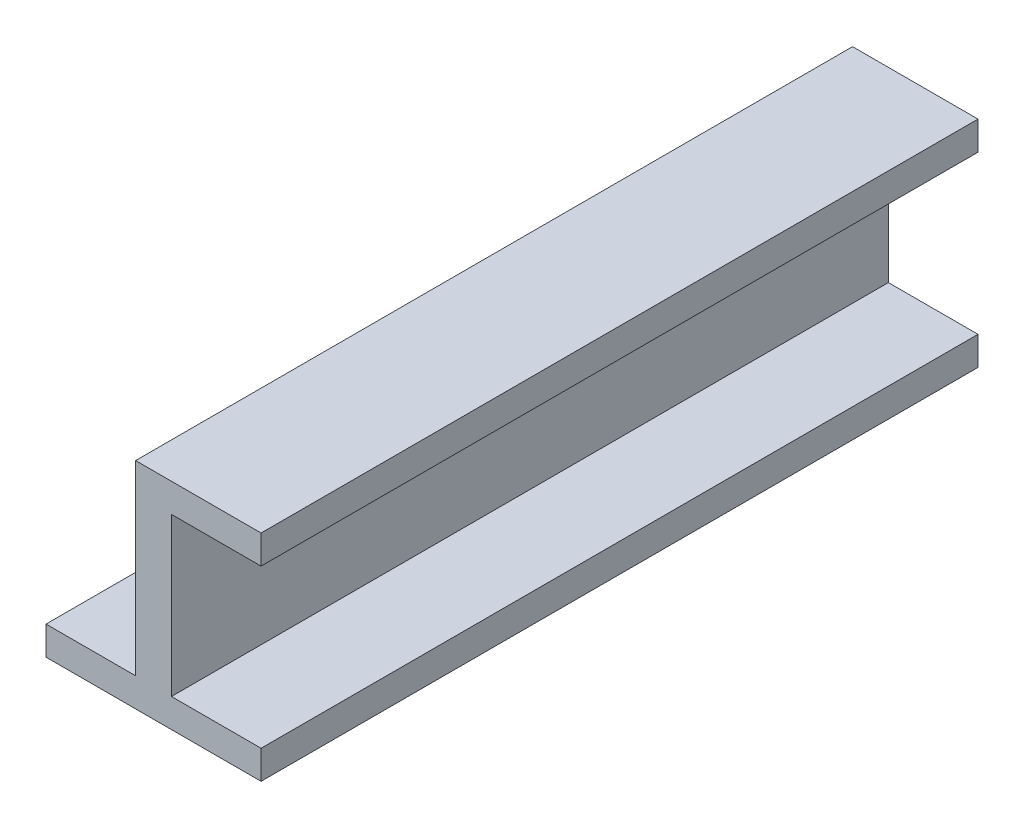
from build123d import *

# Parameters (mm, degrees)
SKETCH_1_W      = 25
SKETCH_1_H      = 8
SKETCH_1_W_2    = 5
EXTRUDE_1_DEPTH = 100


with BuildPart() as part:
    # Эскиз1 → Бобышка-Вытянуть1 (new, symmetric)
    with BuildSketch(Plane.XY):
        with Locations((17.5, -26)):
            Rectangle(SKETCH_1_W, SKETCH_1_H)
        with Locations((2.5, -26)):
            Rectangle(SKETCH_1_W_2, SKETCH_1_H)
        with Locations((-2.5, -26)):
            Rectangle(SKETCH_1_W_2, SKETCH_1_H)
        with Locations((-17.5, -26)):
            Rectangle(SKETCH_1_W, SKETCH_1_H)
        Polygon((0, -22), (5, -22), (5, 22), (0, 22), (0, 30), (-5, 30), (-5, -22), align=None)
        with Locations((17.5, 26)):
            Rectangle(SKETCH_1_W, SKETCH_1_H)
        with Locations((2.5, 26)):
            Rectangle(SKETCH_1_W_2, SKETCH_1_H)
    extrude(amount=EXTRUDE_1_DEPTH, both=True)


solid = part.part
